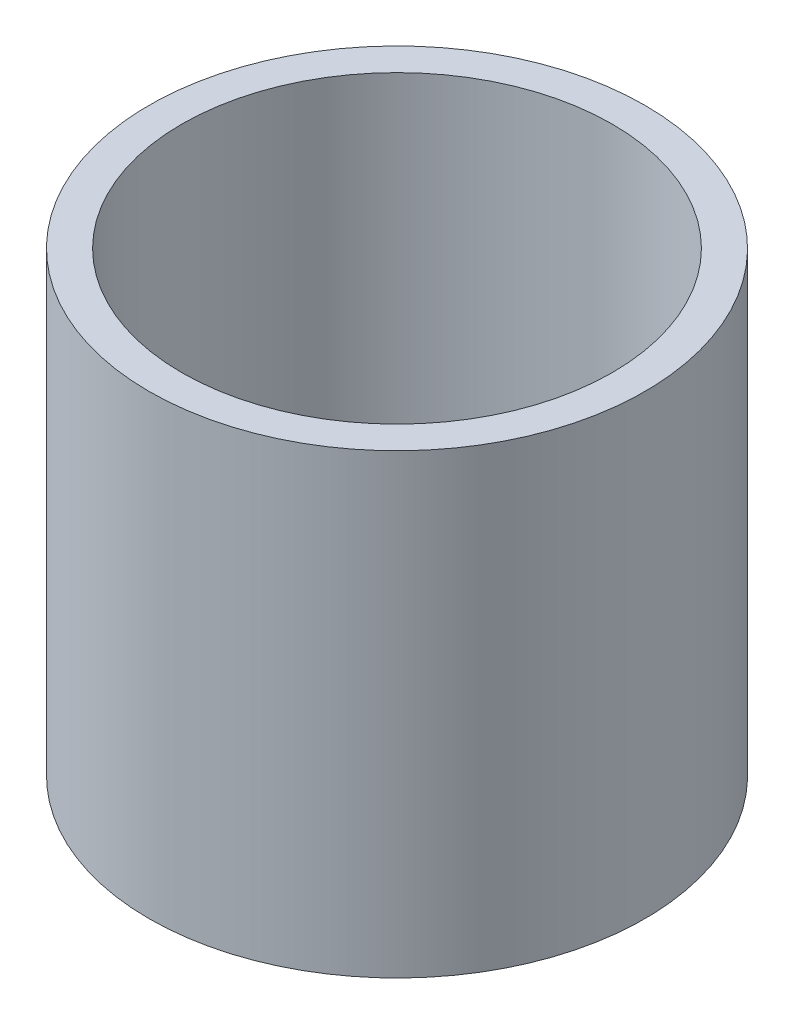
from build123d import *

# Parameters (mm, degrees)
SKETCH_1_R      = 19
EXTRUDE_1_DEPTH = 5
SKETCH_2_R      = 19
SKETCH_2_R_2    = 16.5
EXTRUDE_2_DEPTH = 30


with BuildPart() as part:
    # Эскиз1 → Бобышка-Вытянуть1 (new body)
    with BuildSketch(Plane(origin=(0, 0, 0), x_dir=(1, 0, 0), z_dir=(0, 1, 0))):
        with Locations(Location((0, 0, 0), (0, 0, 270))):
            Circle(SKETCH_1_R)
    extrude(amount=EXTRUDE_1_DEPTH)

    # Эскиз2 → Бобышка-Вытянуть2 (add)
    with BuildSketch(Plane(origin=(0, 5, 0), x_dir=(1, 0, 0), z_dir=(0, 1, 0))):
        with Locations(Location((0, 0, 0), (0, 0, 270))):
            Circle(SKETCH_2_R)
        with Locations(Location((0, 0, 0), (0, 0, 270))):
            Circle(SKETCH_2_R_2, mode=Mode.SUBTRACT)
    extrude(amount=EXTRUDE_2_DEPTH)


solid = part.part
